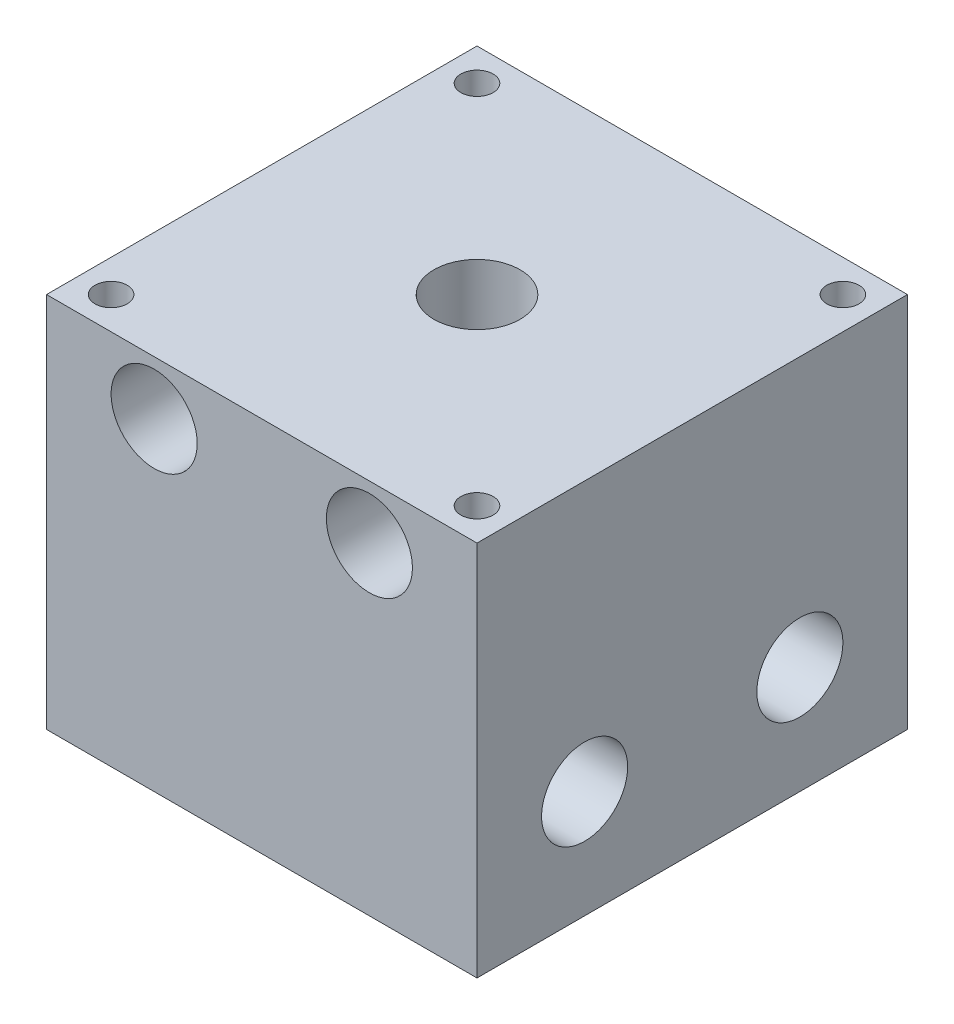
from build123d import *

# Parameters (mm, degrees)
SKETCH1_W           = 40
SKETCH1_H           = 40
BOSS_EXTRUDE1_DEPTH = 45
SKETCH2_R           = 4
CUT_EXTRUDE1_DEPTH  = 45
SKETCH3_R           = 4
CUT_EXTRUDE2_DEPTH  = 45
SKETCH4_R           = 4
SKETCH4_R_2         = 1.5
CUT_EXTRUDE13_DEPTH = 45
SKETCH9_W           = 40
SKETCH9_H           = 10
CUT_EXTRUDE18_DEPTH = 45


with BuildPart() as part:
    # Sketch1 → Boss-Extrude1 (new body)
    with BuildSketch(Plane(origin=(0, 0, 0), x_dir=(1, 0, 0), z_dir=(0, 1, 0))):
        with Locations((20, 20)):
            Rectangle(SKETCH1_W, SKETCH1_H)
    extrude(amount=BOSS_EXTRUDE1_DEPTH)

    # Sketch2 → Cut-Extrude1 (cut)
    with BuildSketch(Plane.XY):
        with Locations((10, 30)):
            Circle(SKETCH2_R)
        with Locations((30, 30)):
            Circle(SKETCH2_R)
    extrude(amount=-CUT_EXTRUDE1_DEPTH, mode=Mode.SUBTRACT)

    # Sketch3 → Cut-Extrude2 (cut)
    with BuildSketch(Plane(origin=(40, 0, 0), x_dir=(0, 0, -1), z_dir=(1, 0, 0))):
        with Locations((10, 10)):
            Circle(SKETCH3_R)
        with Locations((30, 10)):
            Circle(SKETCH3_R)
    extrude(amount=-CUT_EXTRUDE2_DEPTH, mode=Mode.SUBTRACT)

    # Sketch4 → Cut-Extrude13 (cut)
    with BuildSketch(Plane(origin=(0, 45, 0), x_dir=(1, 0, 0), z_dir=(0, 1, 0))):
        with Locations(Location((20, 20, 0), (0, 0, 270))):
            Circle(SKETCH4_R)
        with Locations(Location((3, 3, 0), (0, 0, 270))):
            Circle(SKETCH4_R_2)
        with Locations(Location((3, 37, 0), (0, 0, 270))):
            Circle(SKETCH4_R_2)
        with Locations(Location((37, 37, 0), (0, 0, 270))):
            Circle(SKETCH4_R_2)
        with Locations(Location((37, 3, 0), (0, 0, 270))):
            Circle(SKETCH4_R_2)
    extrude(amount=-CUT_EXTRUDE13_DEPTH, mode=Mode.SUBTRACT)

    # Sketch9 → Cut-Extrude18 (cut)
    with BuildSketch(Plane.XY):
        with Locations((20, 40)):
            Rectangle(SKETCH9_W, SKETCH9_H)
    extrude(amount=-CUT_EXTRUDE18_DEPTH, mode=Mode.SUBTRACT)


solid = part.part
